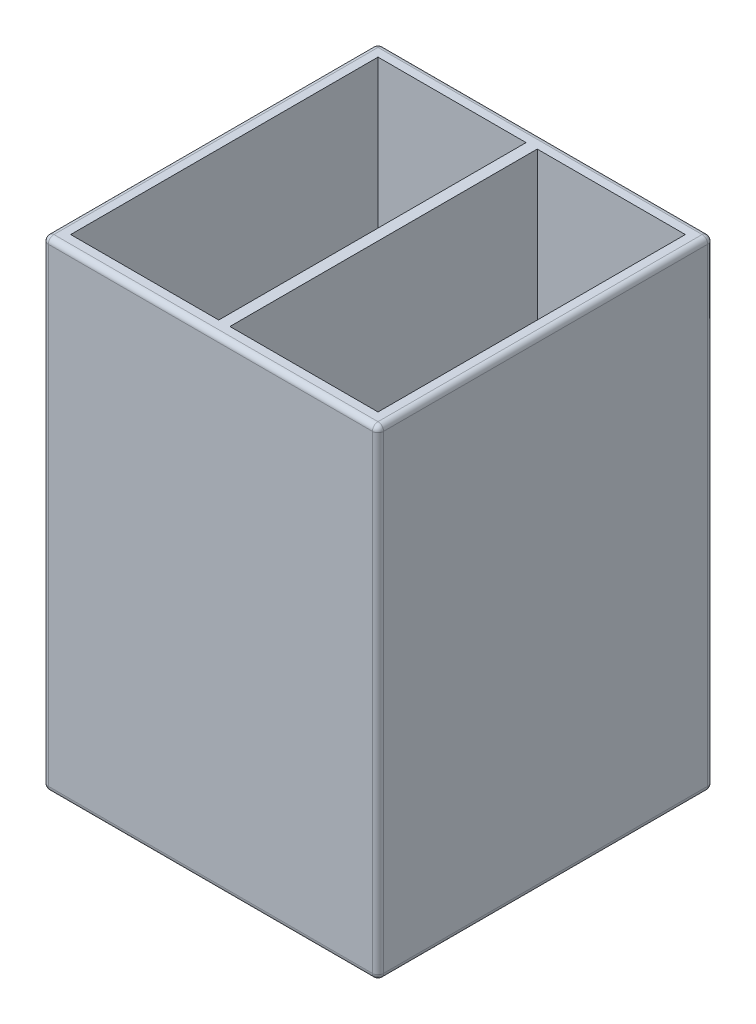
from build123d import *

# Parameters (mm, degrees)
SKETCH3_W           = 76.2
SKETCH3_H           = 76.2
BOSS_EXTRUDE1_DEPTH = 109.22
SKETCH4_W           = 33.655
SKETCH4_H           = 69.85
CUT_EXTRUDE2_DEPTH  = 101.6
FILLET10_R          = 1.27


with BuildPart() as part:
    # Sketch3 → Boss-Extrude1 (new body)
    with BuildSketch(Plane(origin=(0, 0, 0), x_dir=(1, 0, 0), z_dir=(0, 1, 0))):
        with Locations((-125.900159602, -33.824710809)):
            Rectangle(SKETCH3_W, SKETCH3_H)
    extrude(amount=BOSS_EXTRUDE1_DEPTH)

    # Sketch4 → Cut-Extrude2 (cut)
    with BuildSketch(Plane(origin=(0, 109.22, 0), x_dir=(1, 0, 0), z_dir=(0, 1, 0))):
        with Locations((-143.997659602, -33.824710809)):
            Rectangle(SKETCH4_W, SKETCH4_H)
        with Locations((-107.802659602, -33.824710809)):
            Rectangle(SKETCH4_W, SKETCH4_H)
    extrude(amount=-CUT_EXTRUDE2_DEPTH, mode=Mode.SUBTRACT)

    # Fillet10
    fillet10_edges = [part.edges().sort_by_distance(p)[0] for p in [
        (-87.800159602, 109.22, 33.824710809),
        (-125.900159602, 109.22, -4.275289191),
        (-124.630159602, 7.62, 33.824710809),
        (-164.000159602, 109.22, 33.824710809),
        (-125.900159602, 0, -4.275289191),
        (-87.800159602, 0, 33.824710809),
        (-125.900159602, 0, 71.924710809),
        (-164.000159602, 0, 33.824710809),
        (-164.000159602, 54.61, -4.275289191),
        (-87.800159602, 54.61, -4.275289191),
        (-87.800159602, 54.61, 71.924710809),
        (-164.000159602, 54.61, 71.924710809),
        (-125.900159602, 109.22, 71.924710809),
    ]]
    fillet(fillet10_edges, radius=FILLET10_R)


solid = part.part
